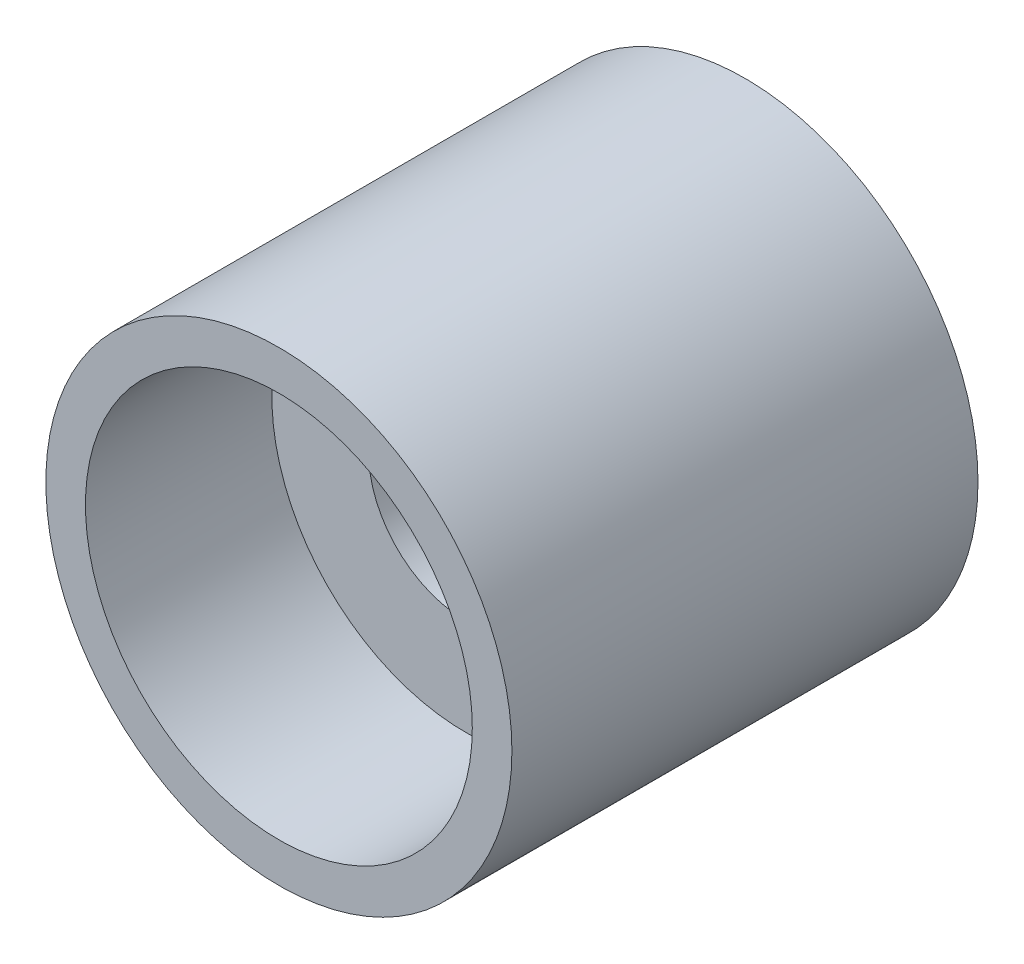
from build123d import *

# Parameters (mm, degrees)
SKETCH1_R           = 10
SKETCH1_R_2         = 4.15
BOSS_EXTRUDE1_DEPTH = 20
SKETCH2_R           = 8.3
CUT_EXTRUDE1_DEPTH  = 8


with BuildPart() as part:
    # Sketch1 → Boss-Extrude1 (new body)
    with BuildSketch(Plane.XY):
        Circle(SKETCH1_R)
        Circle(SKETCH1_R_2, mode=Mode.SUBTRACT)
    extrude(amount=BOSS_EXTRUDE1_DEPTH)

    # Sketch2 → Cut-Extrude1 (cut)
    with BuildSketch(Plane.XY.offset(20)):
        Circle(SKETCH2_R)
    extrude(amount=-CUT_EXTRUDE1_DEPTH, mode=Mode.SUBTRACT)


solid = part.part
